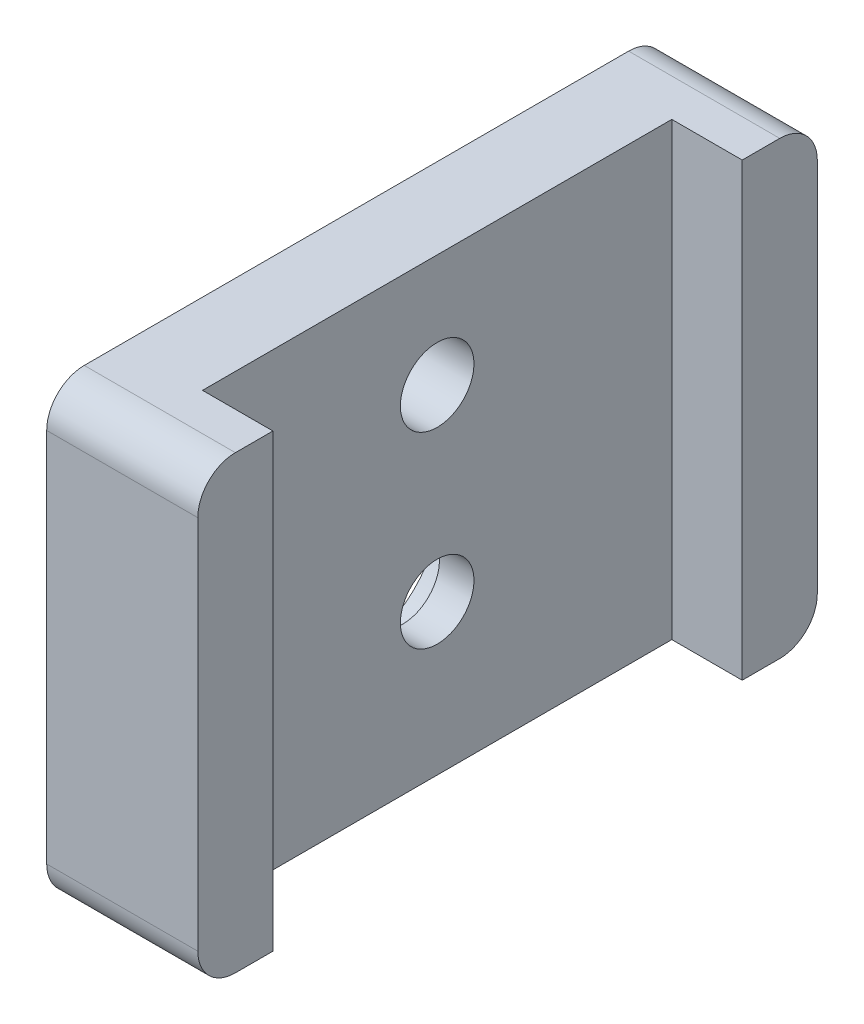
from build123d import *

# Parameters (mm, degrees)
BOSS_EXTRUDE1_DEPTH                                 = 5.461
F_10_CLEARANCE_HOLE1_D                              = 4.9784
CBORE_FOR_10_BINDING_HEAD_MACHINE_SCREW_D           = 4.9784
CBORE_FOR_10_BINDING_HEAD_MACHINE_SCREW_CBORE_D     = 11.1125
CBORE_FOR_10_BINDING_HEAD_MACHINE_SCREW_CBORE_DEPTH = 3.1242
SKETCH10_W                                          = 5.08
SKETCH10_H                                          = 30.48
BOSS_EXTRUDE2_DEPTH                                 = 4.7625
FILLET2_R                                           = 2.54


with BuildPart() as part:
    # Sketch1 → Boss-Extrude1 (new body)
    with BuildSketch(Plane(origin=(0, 0, 0), x_dir=(0, 0, -1), z_dir=(1, 0, 0))):
        Polygon((-15.875, -15.24), (15.875, -15.24), (20.955, -15.24), (20.955, 15.24), (15.875, 15.24), (-15.875, 15.24), (-20.955, 15.24), (-20.955, -15.24), align=None)
    extrude(amount=BOSS_EXTRUDE1_DEPTH)

    # #10 Clearance Hole1 (through all)
    with Locations(Plane.ZY):
        with Locations((0, 7.62)):
            Hole(F_10_CLEARANCE_HOLE1_D / 2)

    # CBORE for #10 Binding Head Machine Screw1 (through all)
    with Locations(Plane.ZY):
        with Locations((0, -5.08)):
            CounterBoreHole(CBORE_FOR_10_BINDING_HEAD_MACHINE_SCREW_D / 2, CBORE_FOR_10_BINDING_HEAD_MACHINE_SCREW_CBORE_D / 2, CBORE_FOR_10_BINDING_HEAD_MACHINE_SCREW_CBORE_DEPTH)

    # Sketch10 → Boss-Extrude2 (add)
    with BuildSketch(Plane(origin=(5.461, 0, 0), x_dir=(0, 0, -1), z_dir=(1, 0, 0))):
        with Locations((-18.415, 0)):
            Rectangle(SKETCH10_W, SKETCH10_H)
        with Locations((18.415, 0)):
            Rectangle(SKETCH10_W, SKETCH10_H)
    extrude(amount=BOSS_EXTRUDE2_DEPTH)

    # Fillet2
    fillet2_edges = [part.edges().sort_by_distance(p)[0] for p in [
        (5.11175, 15.24, -20.955),
        (5.11175, -15.24, -20.955),
        (5.11175, -15.24, 20.955),
        (5.11175, 15.24, 20.955),
    ]]
    fillet(fillet2_edges, radius=FILLET2_R)


solid = part.part
